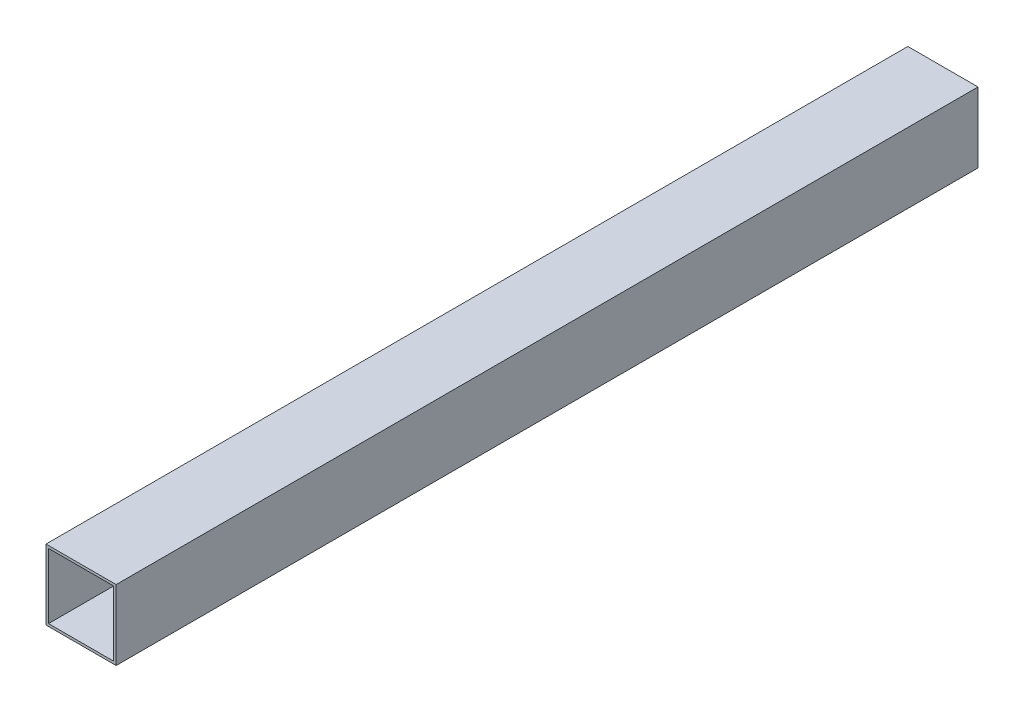
from build123d import *

# Parameters (mm, degrees)
CROQUIS1_W              = 70
CROQUIS1_H              = 70
CROQUIS1_W_2            = 65
CROQUIS1_H_2            = 65
SALIENTE_EXTRUIR1_DEPTH = 430


with BuildPart() as part:
    # Croquis1 → Saliente-Extruir1 (new, symmetric)
    with BuildSketch(Plane.XY):
        Rectangle(CROQUIS1_W, CROQUIS1_H)
        Rectangle(CROQUIS1_W_2, CROQUIS1_H_2, mode=Mode.SUBTRACT)
    extrude(amount=SALIENTE_EXTRUIR1_DEPTH, both=True)


solid = part.part
